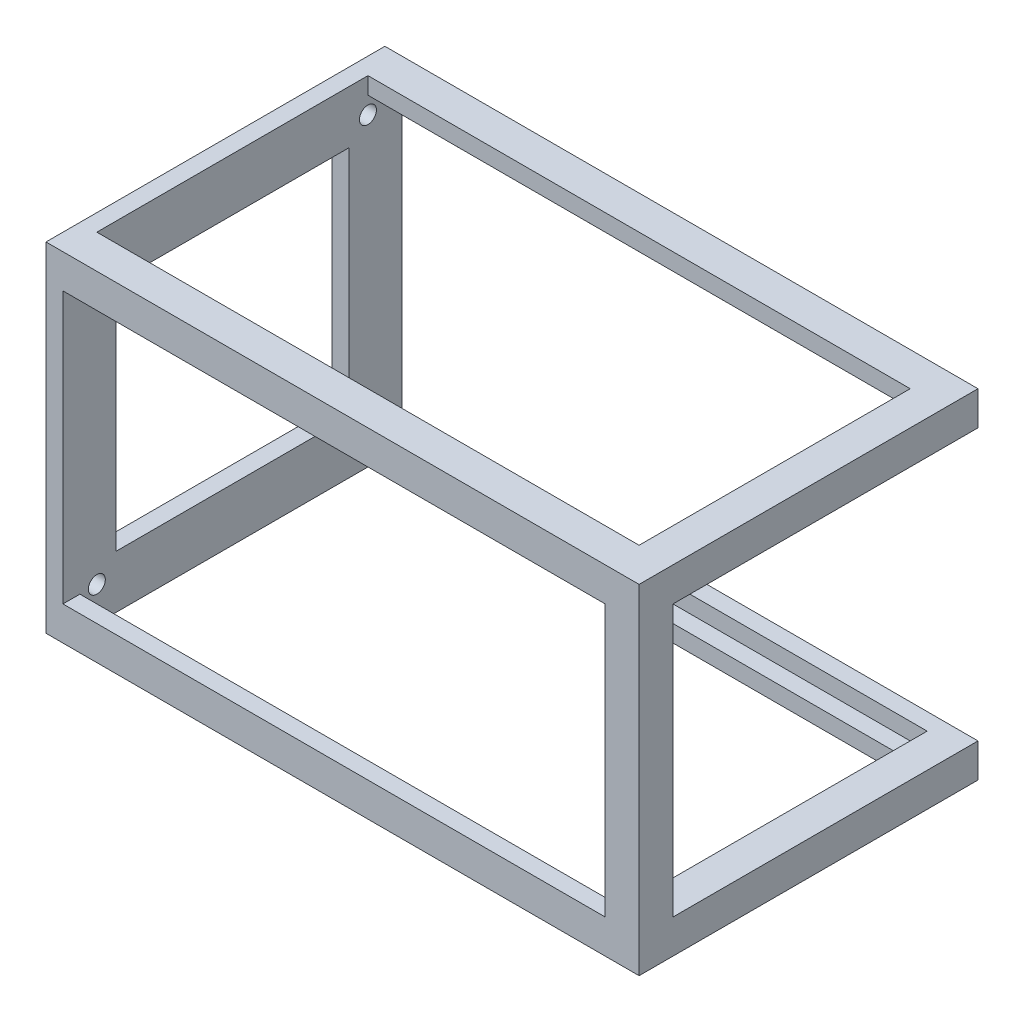
from build123d import *

# Parameters (mm, degrees)
CROQUIS1_W              = 80
CROQUIS1_H              = 80
SALIENTE_EXTRUIR1_DEPTH = 140
CORTAR_EXTRUIR3_DEPTH   = 136
CROQUIS8_R              = 2
CROQUIS8_W              = 55
CROQUIS8_H              = 55
CORTAR_EXTRUIR4_DEPTH   = 136
SALIENTE_EXTRUIR4_DEPTH = 8


with BuildPart() as part:
    # Croquis1 → Saliente-Extruir1 (new body)
    with BuildSketch(Plane.YZ):
        Rectangle(CROQUIS1_W, CROQUIS1_H)
    extrude(amount=SALIENTE_EXTRUIR1_DEPTH)

    # Croquis7 → Cortar-Extruir3 (cut)
    with BuildSketch(Plane.YZ.offset(140)):
        Polygon((-40, 32.000605379), (-36, 32.000605379), (-36, 36), (-32, 36), (-32, 40), (32, 40), (32, 36), (36, 36), (36, 32.000605379), (40, 32.000605379), (40, -32.000605379), (36, -32.000605379), (36, -36), (32, -36), (32, -40), (-32, -40), (-32, -36), (-36, -36), (-36, -32.000605379), (-40, -32.000605379), align=None)
    extrude(amount=-CORTAR_EXTRUIR3_DEPTH, mode=Mode.SUBTRACT)

    # Croquis8 → Cortar-Extruir4 (cut)
    with BuildSketch(Plane.YZ.offset(4)):
        with Locations(Location((-32, 32, 0), (0, 0, 270))):
            Circle(CROQUIS8_R)
        with Locations(Location((-32, -32, 0), (0, 0, 270))):
            Circle(CROQUIS8_R)
        with Locations(Location((32, -32, 0), (0, 0, 270))):
            Circle(CROQUIS8_R)
        with Locations(Location((32, 32, 0), (0, 0, 270))):
            Circle(CROQUIS8_R)
        Rectangle(CROQUIS8_W, CROQUIS8_H)
    extrude(amount=-CORTAR_EXTRUIR4_DEPTH, mode=Mode.SUBTRACT)

    # Croquis9 → Saliente-Extruir4 (add)
    with BuildSketch(Plane.YZ.offset(140)):
        Polygon((32, -40), (40, -40), (40, 40), (-40, 40), (-40, -40), (-32, -40), (-32, 32), (32, 32), align=None)
    extrude(amount=-SALIENTE_EXTRUIR4_DEPTH)


solid = part.part
